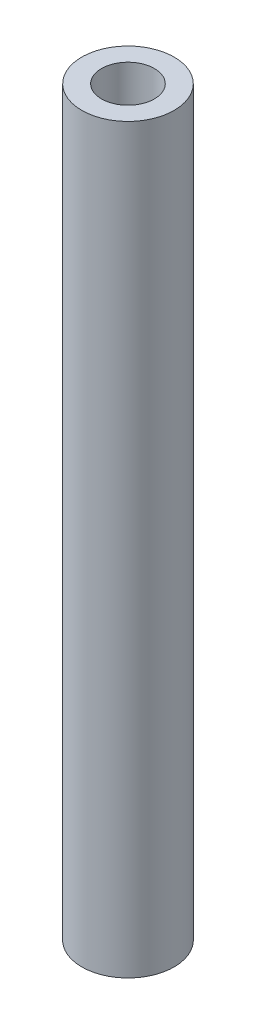
from build123d import *

# Parameters (mm, degrees)
SKETCH_1_R      = 3.5
SKETCH_1_R_2    = 2
EXTRUDE_1_DEPTH = 28.1


with BuildPart() as part:
    # 草图1 → 凸台-拉伸1 (new, symmetric)
    with BuildSketch(Plane(origin=(0, 0, 0), x_dir=(1, 0, 0), z_dir=(0, 1, 0))):
        with Locations(Location((0, 0, 0), (0, 0, 270))):
            Circle(SKETCH_1_R)
        with Locations(Location((0, 0, 0), (0, 0, 270))):
            Circle(SKETCH_1_R_2, mode=Mode.SUBTRACT)
    extrude(amount=EXTRUDE_1_DEPTH, both=True)


solid = part.part
